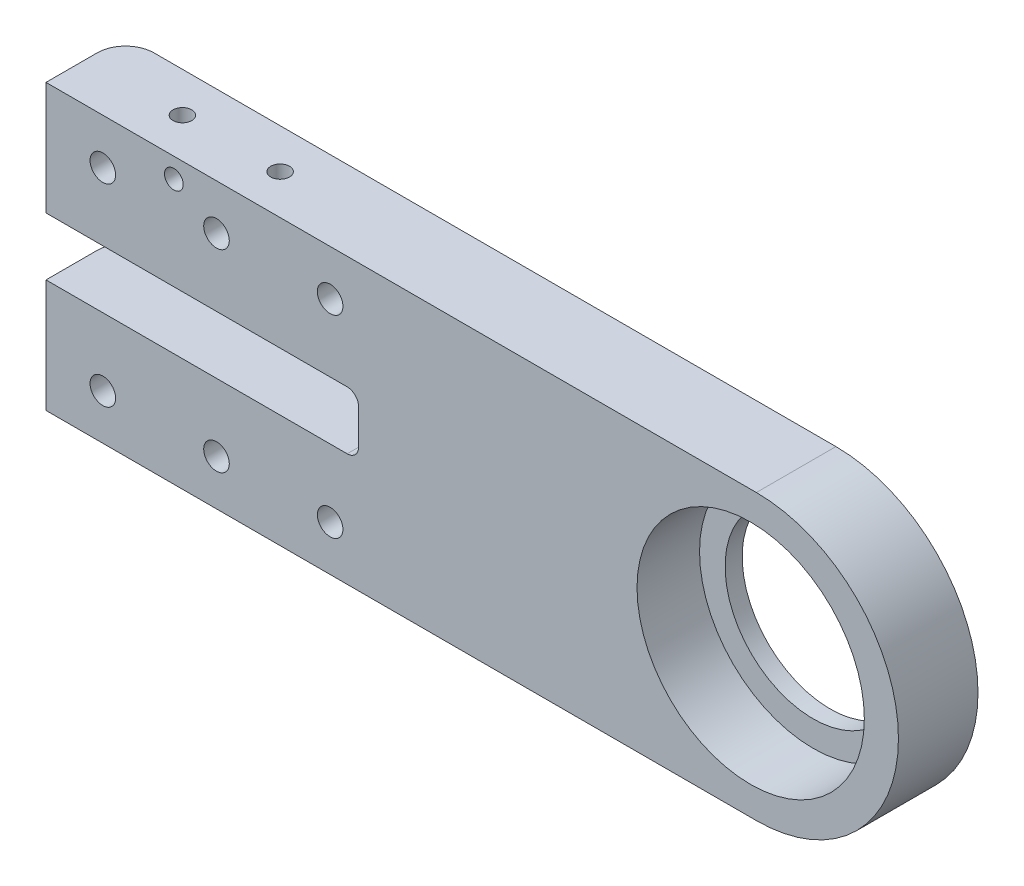
from build123d import *

# Parameters (mm, degrees)
BOSS_EXTRUDE1_DEPTH       = 14
SKETCH2_W                 = 55
SKETCH2_H                 = 10.2
CUT_EXTRUDE1_DEPTH        = 159.732479348
F_8_CLEARANCE_HOLE1_D     = 4.5
F_4_CLEARANCE_HOLE1_D     = 3.3
F_4_CLEARANCE_HOLE2_D     = 3.3
F_4_CLEARANCE_HOLE2_DEPTH = 19.899999999
HOLE1_D                   = 31.000000009
HOLE1_CBORE_D             = 40.00000001
HOLE1_CBORE_DEPTH         = 11
CHAMFER1_SIZE             = 2.45
FILLET1_R                 = 2
FILLET2_R                 = 5


with BuildPart() as part:
    # Sketch1 → Boss-Extrude1 (new body)
    with BuildSketch(Plane(origin=(0, 0, 0), x_dir=(-1, 0, 0), z_dir=(0, 0, -1))):
        with BuildLine():
            Line((-125, -50), (0, -50))
            Line((0, -50), (0, 0))
            Line((0, 0), (-125, 0))
            ThreePointArc((-125, 0), (-150, -25), (-125, -50))
        make_face()
    extrude(amount=-BOSS_EXTRUDE1_DEPTH)

    # Sketch2 → Cut-Extrude1 (cut, through all)
    with BuildSketch(Plane.XY.offset(14)):
        with Locations((27.5, -24.999999999)):
            Rectangle(SKETCH2_W, SKETCH2_H)
    extrude(amount=-CUT_EXTRUDE1_DEPTH, mode=Mode.SUBTRACT)

    # #8 Clearance Hole1 (through all)
    with Locations(Plane(origin=(0, 0, 0), x_dir=(-1, 0, 0), z_dir=(0, 0, -1))):
        with Locations((-10, -8), (-10, -42), (-30, -42), (-30, -8), (-50, -8), (-50, -42)):
            Hole(F_8_CLEARANCE_HOLE1_D / 2)

    # #4 Clearance Hole1 (through all)
    with Locations(Plane.XY.offset(14)):
        with Locations((22.5, -3.5)):
            Hole(F_4_CLEARANCE_HOLE1_D / 2)

    # #4 Clearance Hole2
    with Locations(Plane(origin=(0, 0, 0), x_dir=(1, 0, 0), z_dir=(0, 1, 0))):
        with Locations((17, -7), (34.2, -7)):
            Hole(F_4_CLEARANCE_HOLE2_D / 2, depth=F_4_CLEARANCE_HOLE2_DEPTH)

    # Hole1 (through all)
    with Locations(Plane.XY.offset(14)):
        with Locations((123.999999995, -24.999999999)):
            CounterBoreHole(HOLE1_D / 2, HOLE1_CBORE_D / 2, HOLE1_CBORE_DEPTH)

    # Chamfer1
    chamfer1_edges = [part.edges().sort_by_distance(p)[0] for p in [
        (47.75, -42, 0),
        (47.75, -8, 0),
        (27.75, -8, 0),
        (27.75, -42, 0),
        (7.75, -42, 0),
        (7.75, -8, 0),
    ]]
    chamfer(chamfer1_edges, length=CHAMFER1_SIZE)

    # Fillet1
    fillet1_edges = [part.edges().sort_by_distance(p)[0] for p in [
        (55, -19.899999999, 7),
        (55, -30.099999999, 7),
    ]]
    fillet(fillet1_edges, radius=FILLET1_R)

    # Fillet2
    fillet2_edges = [part.edges().sort_by_distance(p)[0] for p in [
        (0, -9.95, 0),
        (0, -40.05, 0),
    ]]
    fillet(fillet2_edges, radius=FILLET2_R)


solid = part.part
